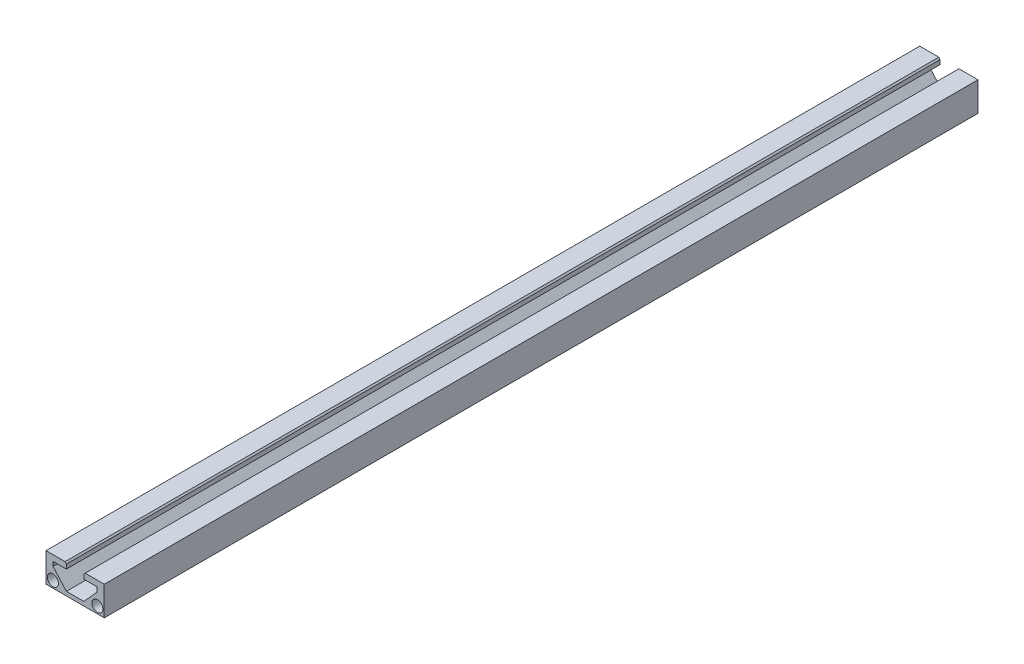
from build123d import *

# Parameters (mm, degrees)
BOSS_EXTRUDE1_DEPTH = 150
SKETCH2_R           = 1.9
CUT_EXTRUDE1_DEPTH  = 301.290281321
SKETCH3_R           = 2
CUT_EXTRUDE2_DEPTH  = 10


with BuildPart() as part:
    # Sketch1 → Boss-Extrude1 (new, symmetric)
    with BuildSketch(Plane.XY):
        Polygon((0, 0), (0, -1.382978723), (10, -1.382978723), (10, 8.617021277), (3.448211747, 8.617021277), (3, 8.117021277), (3, 6.617021277), (7.587018089, 6.617021277), (7.587018089, 5.117021277), (3, 0), align=None)
    boss_extrude1 = extrude(amount=BOSS_EXTRUDE1_DEPTH, both=True)

    # Mirror1: Boss-Extrude1 across plane
    add(boss_extrude1.mirror(Plane(origin=(0, 0, 0), x_dir=(0, 0, 1), z_dir=(1, 0, 0))))

    # Sketch2 → Cut-Extrude1 (cut, through all)
    with BuildSketch(Plane.XY.offset(150)):
        with Locations((7.646716257, 0.97030502)):
            Circle(SKETCH2_R)
    cut_extrude1 = extrude(amount=-CUT_EXTRUDE1_DEPTH, mode=Mode.SUBTRACT)

    # Mirror2: Cut-Extrude1 across plane
    add(cut_extrude1.mirror(Plane(origin=(0, 0, 0), x_dir=(0, 0, 1), z_dir=(1, 0, 0))), mode=Mode.SUBTRACT)

    # Sketch3 → Cut-Extrude2 (cut)
    with BuildSketch(Plane(origin=(0, 0, 0), x_dir=(1, 0, 0), z_dir=(0, 1, 0))):
        with Locations(Location((0, -140, 0), (0, 0, 180))):
            Circle(SKETCH3_R)
    cut_extrude2 = extrude(amount=-CUT_EXTRUDE2_DEPTH, mode=Mode.SUBTRACT)

    # Mirror3: Cut-Extrude2 across plane
    add(cut_extrude2.mirror(Plane.XY), mode=Mode.SUBTRACT)


solid = part.part
